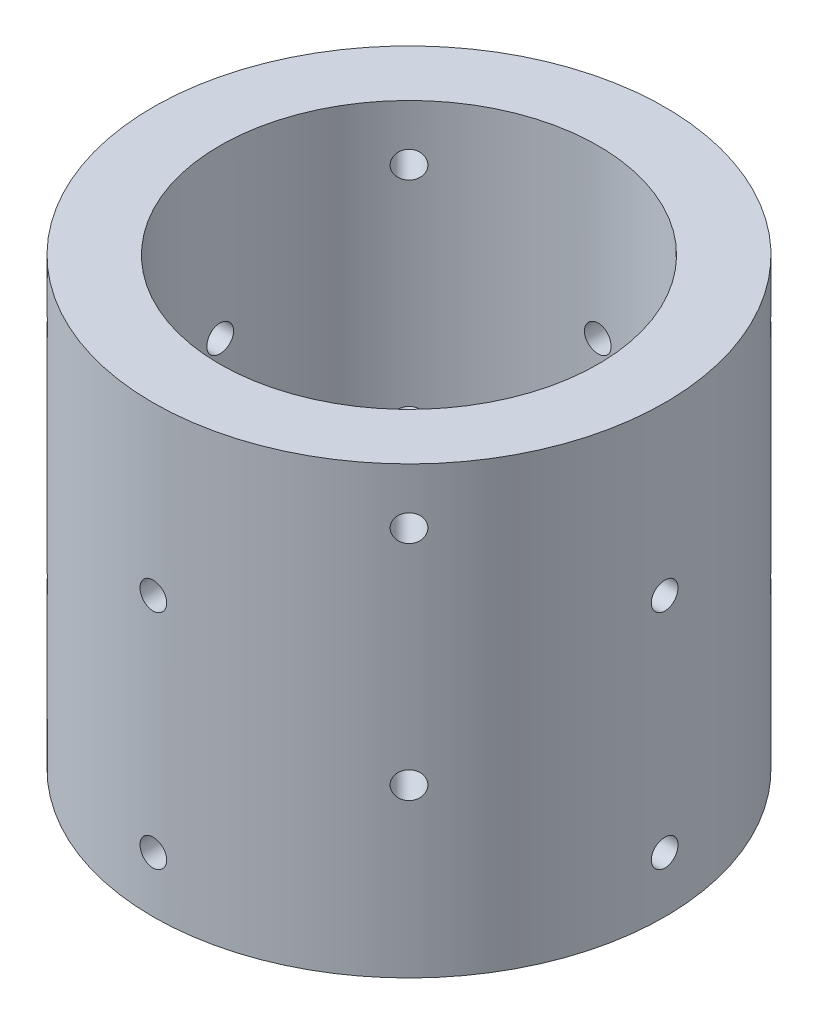
from build123d import *

# Parameters (mm, degrees)
SKETCH_1_R               = 23
EXTRUDE_1_DEPTH          = 10
SKETCH_2_R               = 23
SKETCH_2_R_2             = 17
EXTRUDE_2_DEPTH          = 30
CUT_EXTRUDE_START        = -16.8
SKETCH_3_R               = 1.2
CUT_EXTRUDE_1_DEPTH      = 35.755795019
SKETCH_4_R               = 1.2
CUT_EXTRUDE_2_DEPTH      = 52.55579519
PATTERN_CIRCULAR_1_COUNT = 4
PATTERN_CIRCULAR_2_COUNT = 4


with BuildPart() as part:
    # Эскиз1 → Бобышка-Вытянуть1 (new body)
    with BuildSketch(Plane(origin=(0, 0, 0), x_dir=(1, 0, 0), z_dir=(0, 1, 0))):
        with Locations(Location((0, 0, 0), (0, 0, 270))):
            Circle(SKETCH_1_R)
    extrude(amount=EXTRUDE_1_DEPTH)

    # Эскиз2 → Бобышка-Вытянуть2 (add)
    with BuildSketch(Plane(origin=(0, 10, 0), x_dir=(1, 0, 0), z_dir=(0, 1, 0))):
        with Locations(Location((0, 0, 0), (0, 0, 270))):
            Circle(SKETCH_2_R)
        with Locations(Location((0, 0, 0), (0, 0, 270))):
            Circle(SKETCH_2_R_2, mode=Mode.SUBTRACT)
    extrude(amount=EXTRUDE_2_DEPTH)

    # Эскиз3 → Вырез-Вытянуть1 (cut, through all)
    with BuildSketch(Plane(origin=(0, 0, 0), x_dir=(0, 0, -1), z_dir=(1, 0, 0)).offset(CUT_EXTRUDE_START)):
        with Locations((0, 25)):
            Circle(SKETCH_3_R)
        with Locations((0, 5)):
            Circle(SKETCH_3_R)
    cut_extrude_1 = extrude(amount=-CUT_EXTRUDE_1_DEPTH, mode=Mode.SUBTRACT)

    # Эскиз4 → Вырез-Вытянуть2 (cut, through all)
    with BuildSketch(Plane(origin=(0, 0, 0), x_dir=(0, -1, 0), z_dir=(0.7071067811865464, 0, 0.7071067811865488))):
        with Locations(Location((-15, 0, 0), (0, 0, 90))):
            Circle(SKETCH_4_R)
        with Locations(Location((-35, 0, 0), (0, 0, 90))):
            Circle(SKETCH_4_R)
    cut_extrude_2 = extrude(amount=-CUT_EXTRUDE_2_DEPTH, mode=Mode.SUBTRACT)

    # Круговой массив1: Вырез-Вытянуть1 ×4 about axis
    pattern_circular_1_axis = Axis((0, 0, 0), (0, 1, 0))
    for i in range(1, PATTERN_CIRCULAR_1_COUNT):
        add(cut_extrude_1.rotate(pattern_circular_1_axis, i * 360 / PATTERN_CIRCULAR_1_COUNT), mode=Mode.SUBTRACT)

    # Круговой массив2: Вырез-Вытянуть2 ×4 about axis
    pattern_circular_2_axis = Axis((0, 10, 0), (0, -1, 0))
    for i in range(1, PATTERN_CIRCULAR_2_COUNT):
        add(cut_extrude_2.rotate(pattern_circular_2_axis, i * 360 / PATTERN_CIRCULAR_2_COUNT), mode=Mode.SUBTRACT)


solid = part.part
